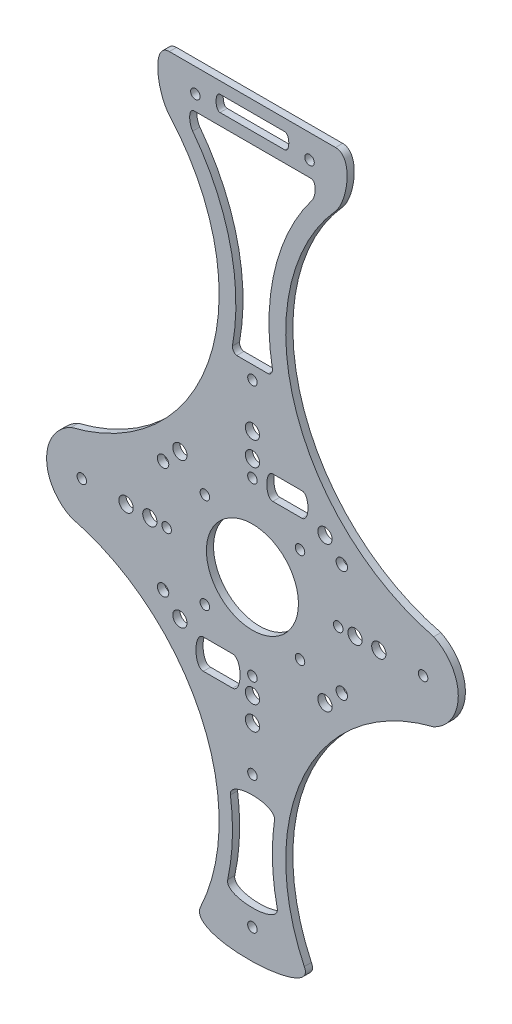
from build123d import *

# Parameters (mm, degrees)
MODEL_R         = 1
MODEL_R_2       = 1.5
MODEL_R_3       = 1.2
MODEL_R_4       = 9.672061212
EXTRUDE_1_DEPTH = 1.5


with BuildPart() as part:
    # Model → 凸台-拉伸1 (new body)
    with BuildSketch(Plane.XY):
        with BuildLine():
            Line((164.249855651, 187.088781669), (146.787217515, 187.088781669))
            Line((146.787217515, 187.088781669), (129.32457938, 187.088781669))
            add(Edge.make_bspline(
                [(129.32457938, 187.088781669), (125.461044671, 187.088781669), (126.746381631, 178.375641151), (129.32457938, 175.498177543)],
                knots=[0, 0, 0, 0, 11.590604126, 11.590604126, 11.590604126, 11.590604126], degree=3))
            ThreePointArc((129.32457938, 175.498177543), (139.773420004, 147.014985412), (127.780187237, 119.146851779))
            ThreePointArc((127.780187237, 119.146851779), (118.967335725, 112.447515783), (108.683438965, 108.350087077))
            ThreePointArc((108.683438965, 108.350087077), (103.514701902, 100.139821501), (108.683438965, 91.929555925))
            ThreePointArc((108.683438965, 91.929555925), (118.967335725, 87.832127219), (127.780187237, 81.132791223))
            ThreePointArc((127.780187237, 81.132791223), (139.177354468, 59.195873616), (135.89135677, 34.694322764))
            add(Edge.make_bspline(
                [(135.89135677, 34.694322764), (132.800282497, 28.120921276), (160.774152533, 29.120921276), (157.683078261, 34.694322764)],
                knots=[0, 0, 0, 0, 21.791721492, 21.791721492, 21.791721492, 21.791721492], degree=3))
            ThreePointArc((157.683078261, 34.694322764), (154.397080563, 59.195873616), (165.794247794, 81.132791223))
            ThreePointArc((165.794247794, 81.132791223), (174.607099306, 87.832127219), (184.890996066, 91.929555925))
            ThreePointArc((184.890996066, 91.929555925), (190.059733129, 100.139821501), (184.890996066, 108.350087077))
            ThreePointArc((184.890996066, 108.350087077), (174.607099306, 112.447515783), (165.794247794, 119.146851779))
            ThreePointArc((165.794247794, 119.146851779), (153.801015027, 147.014985412), (164.249855651, 175.498177543))
            add(Edge.make_bspline(
                [(164.249855651, 187.088781669), (168.11339036, 187.088781669), (166.8280534, 178.375641151), (164.249855651, 175.498177543)],
                knots=[0, 0, 0, 0, 11.590604126, 11.590604126, 11.590604126, 11.590604126], degree=3))
        make_face()
        with Locations((156.787217515, 110.139821501)):
            Circle(MODEL_R, mode=Mode.SUBTRACT)
        with Locations((136.787217515, 110.139821501)):
            Circle(MODEL_R, mode=Mode.SUBTRACT)
        with Locations((136.787217515, 90.139821501)):
            Circle(MODEL_R, mode=Mode.SUBTRACT)
        with Locations((156.787217515, 90.139821501)):
            Circle(MODEL_R, mode=Mode.SUBTRACT)
        with Locations((168.353974342, 100.139821501)):
            Circle(MODEL_R_2, mode=Mode.SUBTRACT)
        with Locations((146.787217515, 121.706578327)):
            Circle(MODEL_R_2, mode=Mode.SUBTRACT)
        with Locations((125.220460689, 100.139821501)):
            Circle(MODEL_R_2, mode=Mode.SUBTRACT)
        with Locations((146.787217515, 78.573064675)):
            Circle(MODEL_R_2, mode=Mode.SUBTRACT)
        with Locations((146.787217515, 126.706578327)):
            Circle(MODEL_R_2, mode=Mode.SUBTRACT)
        with Locations((120.220460689, 100.139821501)):
            Circle(MODEL_R_2, mode=Mode.SUBTRACT)
        with Locations((146.787217515, 73.573064675)):
            Circle(MODEL_R_2, mode=Mode.SUBTRACT)
        with Locations((173.353974342, 100.139821501)):
            Circle(MODEL_R_2, mode=Mode.SUBTRACT)
        with Locations((146.787217515, 118.171044401)):
            Circle(MODEL_R, mode=Mode.SUBTRACT)
        with Locations((128.755994615, 100.139821501)):
            Circle(MODEL_R, mode=Mode.SUBTRACT)
        with Locations((146.787217515, 82.108598601)):
            Circle(MODEL_R, mode=Mode.SUBTRACT)
        with Locations((164.818440415, 100.139821501)):
            Circle(MODEL_R, mode=Mode.SUBTRACT)
        with Locations((162.037217515, 115.389821501)):
            Circle(MODEL_R_2, mode=Mode.SUBTRACT)
        with Locations((131.537217515, 115.389821501)):
            Circle(MODEL_R_2, mode=Mode.SUBTRACT)
        with Locations((131.537217515, 84.889821501)):
            Circle(MODEL_R_2, mode=Mode.SUBTRACT)
        with Locations((162.037217515, 84.889821501)):
            Circle(MODEL_R_2, mode=Mode.SUBTRACT)
        with Locations((182.657217515, 100.139821501)):
            Circle(MODEL_R, mode=Mode.SUBTRACT)
        with Locations((146.787217515, 136.036864466)):
            Circle(MODEL_R, mode=Mode.SUBTRACT)
        with Locations((110.917217515, 100.139821501)):
            Circle(MODEL_R, mode=Mode.SUBTRACT)
        with Locations((146.787217515, 64.242778536)):
            Circle(MODEL_R, mode=Mode.SUBTRACT)
        with Locations((146.787217515, 36.419821501)):
            Circle(MODEL_R, mode=Mode.SUBTRACT)
        with Locations((158.787217515, 182.099821501)):
            Circle(MODEL_R, mode=Mode.SUBTRACT)
        with Locations((134.787217515, 182.099821501)):
            Circle(MODEL_R, mode=Mode.SUBTRACT)
        with Locations((128.00168361, 111.854287595)):
            Circle(MODEL_R_3, mode=Mode.SUBTRACT)
        with Locations((165.572751421, 111.854287595)):
            Circle(MODEL_R_3, mode=Mode.SUBTRACT)
        with Locations((128.00168361, 88.425355407)):
            Circle(MODEL_R_3, mode=Mode.SUBTRACT)
        with Locations((165.572751421, 88.425355407)):
            Circle(MODEL_R_3, mode=Mode.SUBTRACT)
        with Locations((146.787217515, 100.139821501)):
            Circle(MODEL_R_4, mode=Mode.SUBTRACT)
        with BuildLine():
            Line((159.067032454, 178.883153661), (146.787217515, 178.883153661))
            Line((146.787217515, 178.883153661), (134.507402577, 178.883153661))
            add(Edge.make_bspline(
                [(134.507402577, 178.883153661), (133.227688428, 178.883153661), (133.453062144, 176.072728685), (134.227836458, 175.05420374)],
                knots=[0, 0, 0, 0, 3.839142445, 3.839142445, 3.839142445, 3.839142445], degree=3))
            ThreePointArc((134.227836458, 175.05420374), (142.088179874, 158.46992126), (142.587324671, 140.123960438))
            add(Edge.make_bspline(
                [(142.587324671, 140.123960438), (142.493407811, 139.609308925), (142.9625841, 138.837088874), (143.485734707, 138.837088874)],
                knots=[0, 0, 0, 0, 1.56945182, 1.56945182, 1.56945182, 1.56945182], degree=3))
            Line((143.485734707, 138.837088874), (146.787217515, 138.837088874))
            Line((146.787217515, 138.837088874), (150.088700324, 138.837088874))
            add(Edge.make_bspline(
                [(150.98711036, 140.123960438), (151.08102722, 139.609308925), (150.611850931, 138.837088874), (150.088700324, 138.837088874)],
                knots=[0, 0, 0, 0, 1.56945182, 1.56945182, 1.56945182, 1.56945182], degree=3))
            ThreePointArc((150.98711036, 140.123960438), (151.486255157, 158.46992126), (159.346598573, 175.05420374))
            add(Edge.make_bspline(
                [(159.067032454, 178.883153661), (160.346746603, 178.883153661), (160.121372887, 176.072728685), (159.346598573, 175.05420374)],
                knots=[0, 0, 0, 0, 3.839142445, 3.839142445, 3.839142445, 3.839142445], degree=3))
        make_face(mode=Mode.SUBTRACT)
        with BuildLine():
            Line((151.053210178, 121.070269245), (157.209188782, 121.070269245))
            add(Edge.make_bspline(
                [(157.209188782, 121.070269245), (158.876955289, 121.070269245), (158.876955289, 116.066969722), (157.209188782, 116.066969722)],
                knots=[0, 0, 0, 0, 5.003299523, 5.003299523, 5.003299523, 5.003299523], degree=3))
            Line((157.209188782, 116.066969722), (151.053210178, 116.066969722))
            add(Edge.make_bspline(
                [(151.053210178, 121.070269245), (149.38544367, 121.070269245), (149.38544367, 116.066969722), (151.053210178, 116.066969722)],
                knots=[0, 0, 0, 0, 5.003299523, 5.003299523, 5.003299523, 5.003299523], degree=3))
        make_face(mode=Mode.SUBTRACT)
        with BuildLine():
            Line((136.47001729, 84.090392193), (142.625995894, 84.090392193))
            add(Edge.make_bspline(
                [(142.625995894, 84.090392193), (144.706817358, 84.090392193), (144.706817358, 77.847927799), (142.625995894, 77.847927799)],
                knots=[0, 0, 0, 0, 6.242464394, 6.242464394, 6.242464394, 6.242464394], degree=3))
            Line((142.625995894, 77.847927799), (136.47001729, 77.847927799))
            add(Edge.make_bspline(
                [(136.47001729, 84.090392193), (134.389195825, 84.090392193), (134.389195825, 77.847927799), (136.47001729, 77.847927799)],
                knots=[0, 0, 0, 0, 6.242464394, 6.242464394, 6.242464394, 6.242464394], degree=3))
        make_face(mode=Mode.SUBTRACT)
        with BuildLine():
            Line((139.974283877, 181.317718414), (153.600151154, 181.317718414))
            add(Edge.make_bspline(
                [(153.600151154, 184.631261375), (154.704665474, 184.631261375), (154.704665474, 181.317718414), (153.600151154, 181.317718414)],
                knots=[0, 0, 0, 0, 3.313542961, 3.313542961, 3.313542961, 3.313542961], degree=3))
            Line((153.600151154, 184.631261375), (139.974283877, 184.631261375))
            add(Edge.make_bspline(
                [(139.974283877, 184.631261375), (138.869769557, 184.631261375), (138.869769557, 181.317718414), (139.974283877, 181.317718414)],
                knots=[0, 0, 0, 0, 3.313542961, 3.313542961, 3.313542961, 3.313542961], degree=3))
        make_face(mode=Mode.SUBTRACT)
        with BuildLine():
            ThreePointArc((151.414191582, 58.179860404), (151.00262531, 50.30675556), (151.986875507, 42.484580784))
            add(Edge.make_bspline(
                [(141.587559524, 42.484580784), (140.851833579, 39.097117969), (152.722601452, 39.097117969), (151.986875507, 42.484580784)],
                knots=[0, 0, 0, 0, 10.399315983, 10.399315983, 10.399315983, 10.399315983], degree=3))
            ThreePointArc((141.587559524, 42.484580784), (142.57180972, 50.30675556), (142.160243449, 58.179860404))
            add(Edge.make_bspline(
                [(142.160243449, 58.179860404), (141.726972624, 61.233929522), (151.847462407, 61.233929522), (151.414191582, 58.179860404)],
                knots=[0, 0, 0, 0, 9.253948134, 9.253948134, 9.253948134, 9.253948134], degree=3))
        make_face(mode=Mode.SUBTRACT)
    extrude(amount=EXTRUDE_1_DEPTH)


solid = part.part
